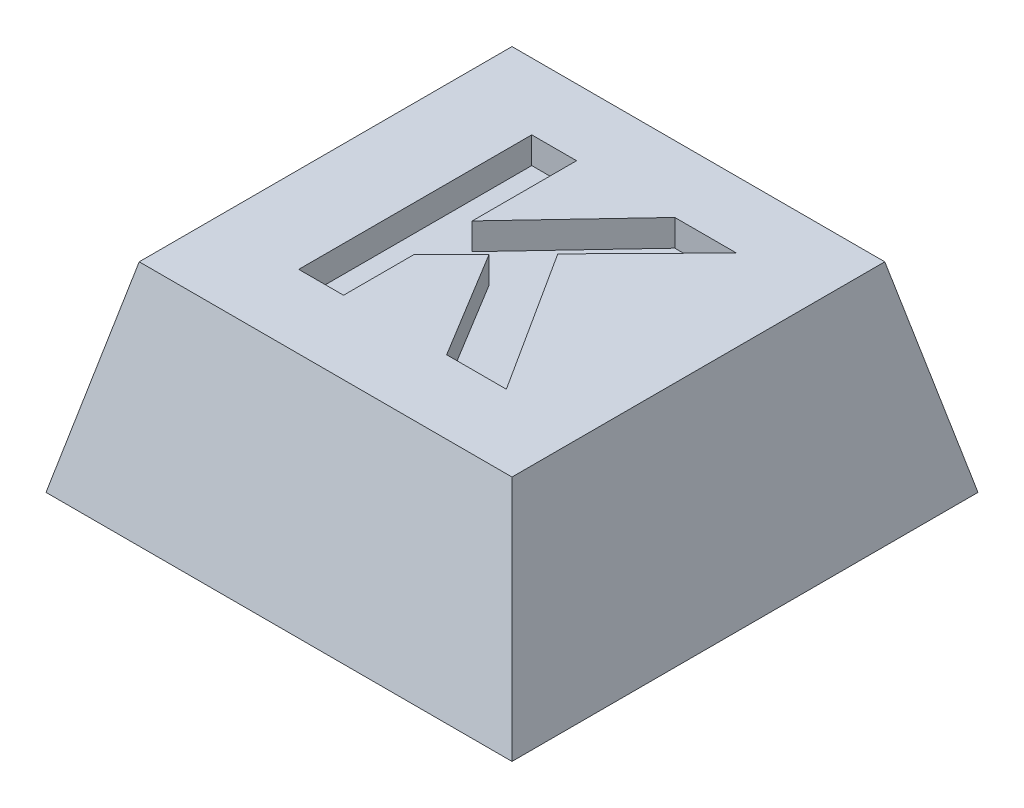
from build123d import *

# Parameters (mm, degrees)
SKETCH1_W           = 7
SKETCH1_H           = 7
BOSS_EXTRUDE1_DEPTH = 3
CUT_EXTRUDE1_DEPTH  = 7
CUT_EXTRUDE2_DEPTH  = 11
SKETCH4_R           = 1.8
CUT_EXTRUDE3_DEPTH  = 0.8
CUT_EXTRUDE4_DEPTH  = 0.4


with BuildPart() as part:
    # Sketch1 → Boss-Extrude1 (new body)
    with BuildSketch(Plane(origin=(0, 0, 0), x_dir=(1, 0, 0), z_dir=(0, 1, 0))):
        with Locations((3.5, 3.5)):
            Rectangle(SKETCH1_W, SKETCH1_H)
    extrude(amount=BOSS_EXTRUDE1_DEPTH)

    # Sketch2 → Cut-Extrude1 (cut)
    with BuildSketch(Plane.XY):
        Polygon((0, 0), (0.7, 3), (0, 3), align=None)
        Polygon((7, 0), (6.3, 3), (7, 3), align=None)
    extrude(amount=-CUT_EXTRUDE1_DEPTH, mode=Mode.SUBTRACT)

    # Sketch3 → Cut-Extrude2 (cut)
    with BuildSketch(Plane(origin=(0, 0, 0), x_dir=(0, 0, -1), z_dir=(1, 0, 0))):
        Polygon((0, 0), (0.7, 3), (0, 3), align=None)
        Polygon((7, 3), (6.3, 3), (7, 0), align=None)
    extrude(amount=CUT_EXTRUDE2_DEPTH, mode=Mode.SUBTRACT)

    # Sketch4 → Cut-Extrude3 (cut)
    with BuildSketch(Plane.XZ):
        with Locations(Location((3.5, -3.5, 0), (0, 0, 270))):
            Circle(SKETCH4_R)
    extrude(amount=-CUT_EXTRUDE3_DEPTH, mode=Mode.SUBTRACT)

    # Sketch5 → Cut-Extrude4 (cut)
    with BuildSketch(Plane(origin=(0, 3, 0), x_dir=(1, 0, 0), z_dir=(0, 1, 0))):
        Polygon((1.996811293, 1.799764157), (1.996811293, 5.299764157), (2.669888216, 5.299764157), (2.669888216, 3.732756946), (4.145749594, 5.299764157), (5.070529242, 5.299764157), (3.741202319, 3.946599093), (5.115401037, 1.799764157), (4.218666261, 1.799764157), (3.230785652, 3.4256656), (2.669888216, 2.854952459), (2.669888216, 1.799764157), align=None)
    extrude(amount=-CUT_EXTRUDE4_DEPTH, mode=Mode.SUBTRACT)


solid = part.part
